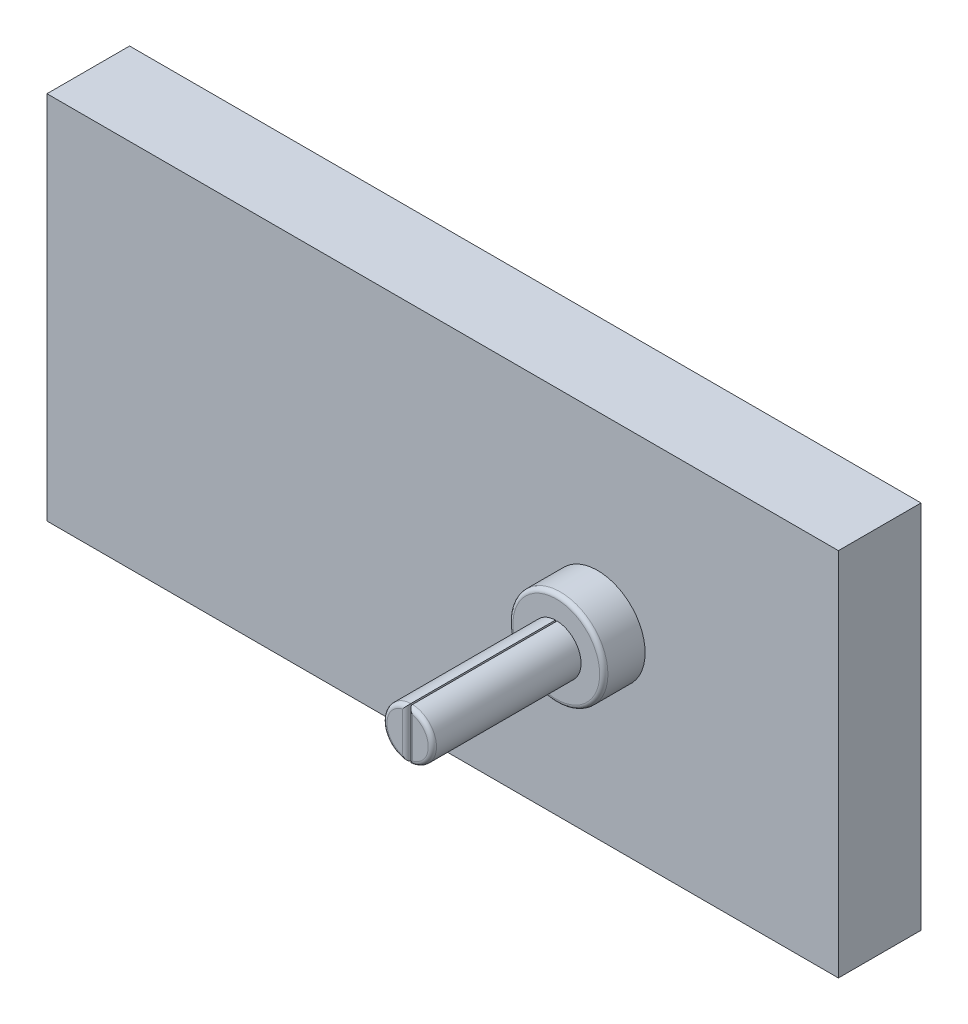
from build123d import *

# Parameters (mm, degrees)
SKETCH1_W              = 95.8
SKETCH1_H              = 44.8
MAINWALL_DEPTH         = 10
SKETCH2_R              = 3
SPRINGAXLE_DEPTH       = 23
SKETCH3_R              = 5.75
SPOOLSUPPORTAXLE_DEPTH = 5
SKETCH4_W              = 0.2
SKETCH4_H              = 20
SLICE_2_DEPTH          = 18
FILLET1_R              = 0.5


with BuildPart() as part:
    # Sketch1 → MainWall (new body)
    with BuildSketch(Plane.XY):
        Rectangle(SKETCH1_W, SKETCH1_H)
    extrude(amount=MAINWALL_DEPTH)

    # Sketch2 → SpringAxle (add)
    with BuildSketch(Plane.XY.offset(10)):
        with Locations((18.75, 0)):
            Circle(SKETCH2_R)
    extrude(amount=SPRINGAXLE_DEPTH)

    # Sketch3 → SpoolSupportAxle (add)
    with BuildSketch(Plane.XY.offset(10)):
        with Locations((18.75, 0)):
            Circle(SKETCH3_R)
    extrude(amount=SPOOLSUPPORTAXLE_DEPTH)

    # Sketch4 → Slice 2 (cut)
    with BuildSketch(Plane.XY.offset(33)):
        with Locations((18.75, 0)):
            Rectangle(SKETCH4_W, SKETCH4_H)
    extrude(amount=-SLICE_2_DEPTH, mode=Mode.SUBTRACT)

    # Fillet1
    fillet1_edges = [part.edges().sort_by_distance(p)[0] for p in [
        (13, 0, 15),
        (15.75, 0, 33),
        (21.75, 0, 33),
        (18.85, 0, 33),
        (18.65, 0, 33),
    ]]
    fillet(fillet1_edges, radius=FILLET1_R)


solid = part.part
